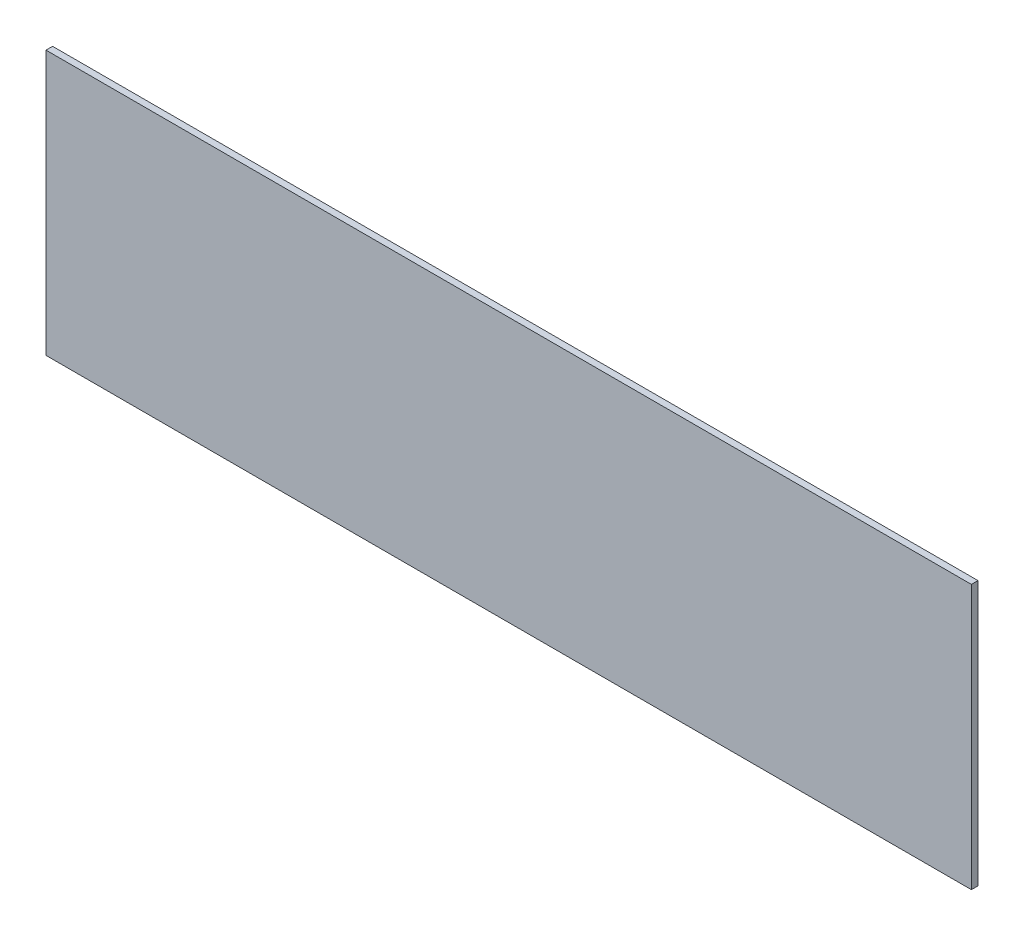
from build123d import *

# Parameters (mm, degrees)
SKETCH1_W           = 1400
SKETCH1_H           = 400
BOSS_EXTRUDE1_DEPTH = 10


with BuildPart() as part:
    # Sketch1 → Boss-Extrude1 (new body)
    with BuildSketch(Plane.XY):
        with Locations((0, -100)):
            Rectangle(SKETCH1_W, SKETCH1_H)
    extrude(amount=BOSS_EXTRUDE1_DEPTH)


solid = part.part
